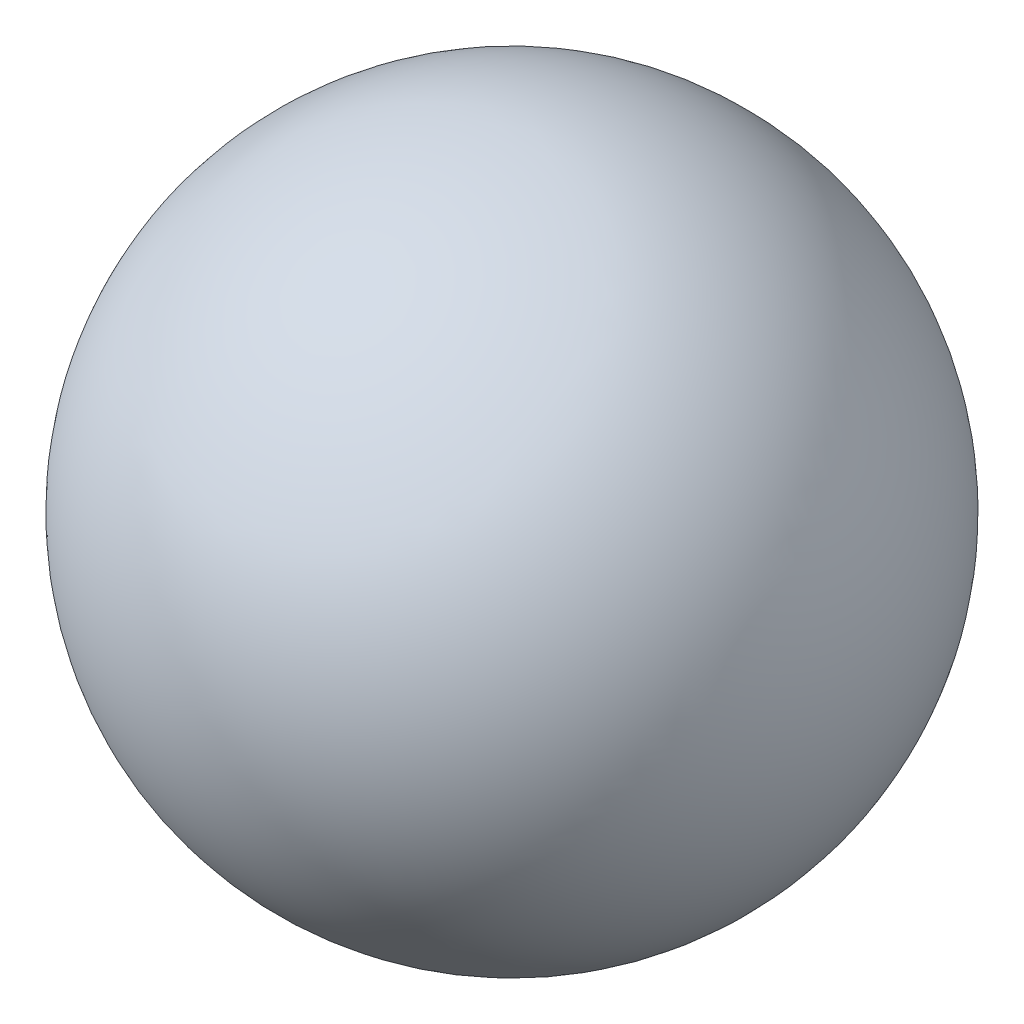
from build123d import *


with BuildPart() as part:
    # Sketch1 → Revolve1 (revolve)
    with BuildSketch(Plane(origin=(0, 0, 0), x_dir=(-1, 0, 0), z_dir=(0, 0, -1))):
        with BuildLine():
            Line((3.209989756, 0), (4.727510244, 0))
            ThreePointArc((4.727510244, 0), (3.96875, 0.758760244), (3.209989756, 0))
        make_face()
    revolve(axis=Axis((-3.209989756, 0, 0), (-1, 0, 0)))


solid = part.part
